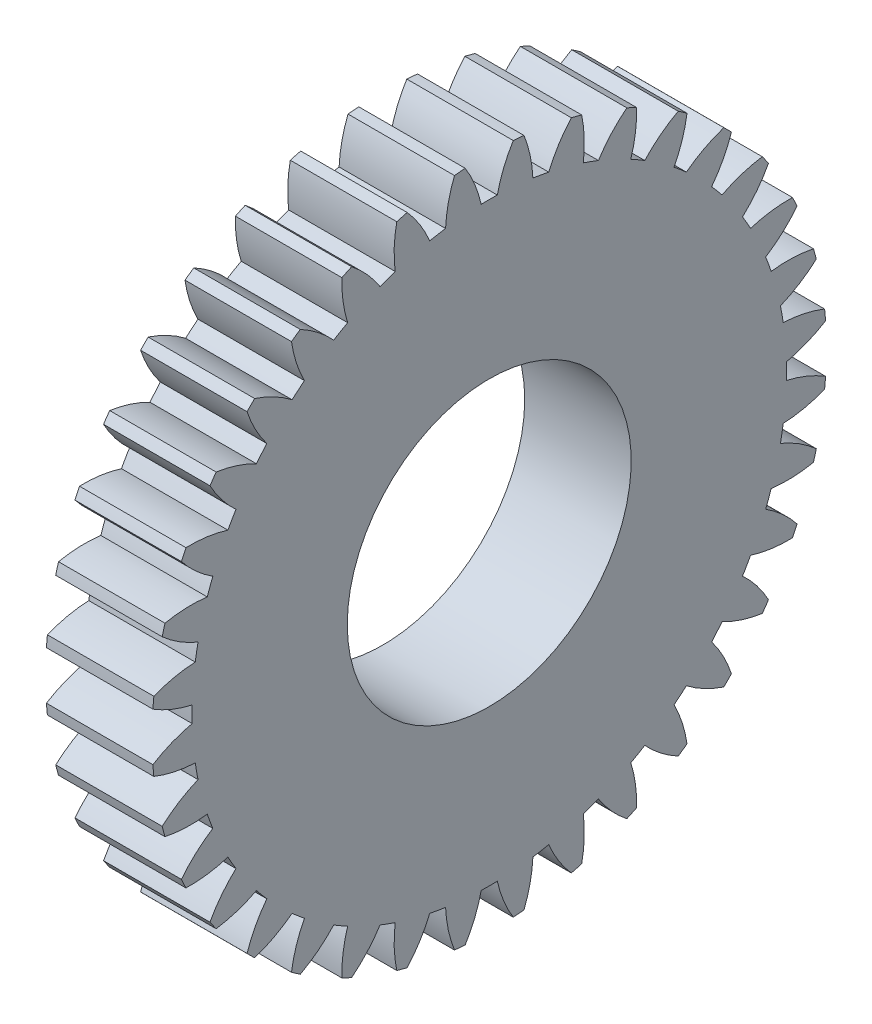
from build123d import *

# Parameters (mm, degrees)
BASPROSKE_W     = 3
BASPROSKE_H     = 9.5
TOOTHCUT_DEPTH  = 14.765899898
TEETHCUTS_COUNT = 36
TEETHCUTS_ANGLE = 350
BORSKE_R        = 4
BORE_DEPTH      = 50.0000508


with BuildPart() as part:
    # BasProSke → Base-Revolve (revolve)
    with BuildSketch(Plane(origin=(0, 0, 0), x_dir=(1, 0, 0), z_dir=(0, 1, 0)), mode=Mode.PRIVATE) as base_revolve_sk:
        with Locations((1.5, 4.75)):
            Rectangle(BASPROSKE_W, BASPROSKE_H)
    revolve(base_revolve_sk.sketch.rotate(Axis((-10, 0, 0), (1, 0, 0)), 180), axis=Axis((-10, 0, 0), (1, 0, 0)))

    # TooCutSke → ToothCut (cut, through all)
    with BuildSketch(Plane(origin=(0, 0, 0), x_dir=(0, 0, -1), z_dir=(1, 0, 0))):
        with BuildLine():
            ThreePointArc((0.227221176, 8.370916708), (0, 8.374), (-0.227221176, 8.370916708))
            ThreePointArc((-0.227221176, 8.370916708), (-0.411410437, 8.955426484), (-0.69207336, 9.500225241))
            ThreePointArc((-0.69207336, 9.500225241), (0, 9.5254), (0.69207336, 9.500225241))
            ThreePointArc((0.69207336, 9.500225241), (0.411410437, 8.955426484), (0.227221176, 8.370916708))
        make_face()
    toothcut = extrude(amount=TOOTHCUT_DEPTH, mode=Mode.SUBTRACT)

    # TeethCuts: ToothCut ×36 about axis
    teethcuts_axis = Axis((-10, 0, 0), (1, 0, 0))
    for i in range(1, TEETHCUTS_COUNT):
        add(toothcut.rotate(teethcuts_axis, i * TEETHCUTS_ANGLE / (TEETHCUTS_COUNT - 1)), mode=Mode.SUBTRACT)

    # BorSke → Bore (cut, symmetric)
    with BuildSketch(Plane(origin=(0, 0, 0), x_dir=(0, 0, -1), z_dir=(1, 0, 0))):
        with Locations(Location((0, 0, 0), (0, 0, 180))):
            Circle(BORSKE_R)
    extrude(amount=BORE_DEPTH, both=True, mode=Mode.SUBTRACT)


solid = part.part
